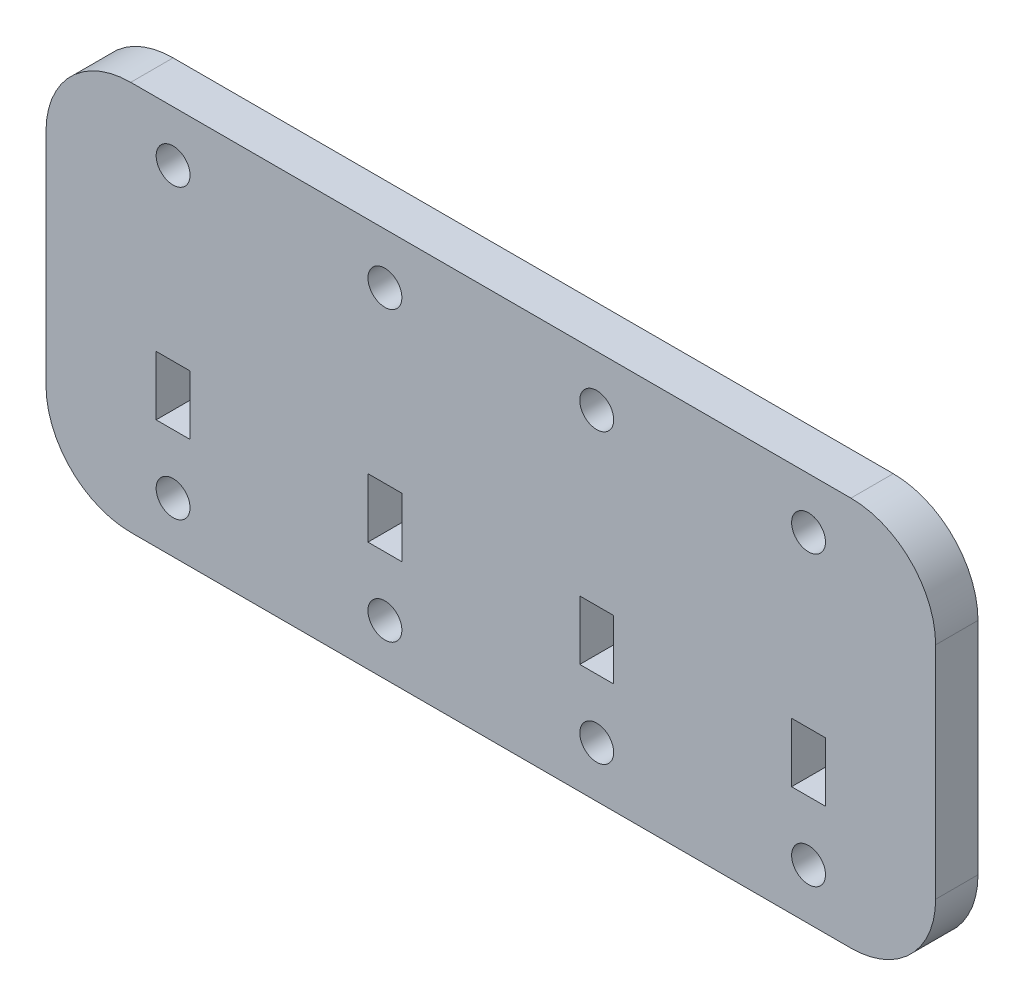
from build123d import *

# Parameters (mm, degrees)
ESQUISSE1_W        = 105
ESQUISSE1_H        = 46
ESQUISSE1_R        = 2
ESQUISSE1_W_2      = 4
ESQUISSE1_H_2      = 7
BOSS_EXTRU_1_DEPTH = 5
CONG_1_R           = 10


with BuildPart() as part:
    # Esquisse1 → Boss.-Extru.1 (new body)
    with BuildSketch(Plane.XY):
        with Locations((52.5, 23)):
            Rectangle(ESQUISSE1_W, ESQUISSE1_H)
        with Locations((15, 6)):
            Circle(ESQUISSE1_R, mode=Mode.SUBTRACT)
        with Locations((15, 40)):
            Circle(ESQUISSE1_R, mode=Mode.SUBTRACT)
        with Locations((40, 40)):
            Circle(ESQUISSE1_R, mode=Mode.SUBTRACT)
        with Locations((40, 6)):
            Circle(ESQUISSE1_R, mode=Mode.SUBTRACT)
        with Locations((65, 40)):
            Circle(ESQUISSE1_R, mode=Mode.SUBTRACT)
        with Locations((65, 6)):
            Circle(ESQUISSE1_R, mode=Mode.SUBTRACT)
        with Locations((90, 40)):
            Circle(ESQUISSE1_R, mode=Mode.SUBTRACT)
        with Locations((90, 6)):
            Circle(ESQUISSE1_R, mode=Mode.SUBTRACT)
        with Locations((40, 16.5)):
            Rectangle(ESQUISSE1_W_2, ESQUISSE1_H_2, mode=Mode.SUBTRACT)
        with Locations((15, 16.5)):
            Rectangle(ESQUISSE1_W_2, ESQUISSE1_H_2, mode=Mode.SUBTRACT)
        with Locations((65, 16.5)):
            Rectangle(ESQUISSE1_W_2, ESQUISSE1_H_2, mode=Mode.SUBTRACT)
        with Locations((90, 16.5)):
            Rectangle(ESQUISSE1_W_2, ESQUISSE1_H_2, mode=Mode.SUBTRACT)
    extrude(amount=BOSS_EXTRU_1_DEPTH)

    # Congé1
    cong_1_edges = [part.edges().sort_by_distance(p)[0] for p in [
        (0, 46, 2.5),
        (105, 46, 2.5),
        (105, 0, 2.5),
        (0, 0, 2.5),
    ]]
    fillet(cong_1_edges, radius=CONG_1_R)


solid = part.part
